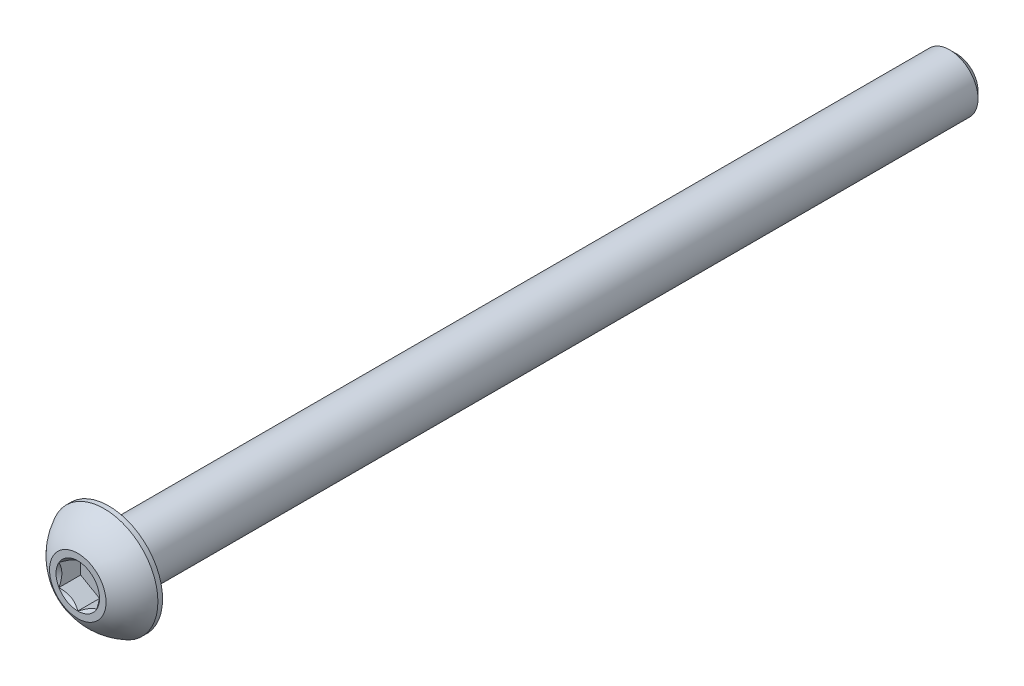
from build123d import *

# Parameters (mm, degrees)
CUT_EXTRUDE2_DEPTH = 1.155


with BuildPart() as part:
    # Sketch10 → Revolve3 (revolve)
    with BuildSketch(Plane(origin=(0, 0, 0), x_dir=(0, 0, -1), z_dir=(1, 0, 0))):
        Polygon((46.275, 1.5), (46.65, 1.125), (46.65, 0), (1.65, 0), (1.65, 1.5), align=None)
    revolve(axis=Axis((0, 0, 0), (0, 0, -1)))

    # Sketch7 → Revolve2 (revolve)
    with BuildSketch(Plane(origin=(0, 0, 0), x_dir=(0, 0, -1), z_dir=(1, 0, 0))):
        with BuildLine():
            Line((1.4025, 2.85), (1.65, 2.85))
            Line((1.65, 2.85), (1.65, 0))
            Line((1.65, 0), (0, 0))
            Line((0, 0), (0, 1.5))
            ThreePointArc((0, 1.5), (0.59512511, 2.285251969), (1.4025, 2.85))
        make_face()
    revolve(axis=Axis((0, 0, 0), (0, 0, -1)))

    # Sketch5 → Cut-Extrude2 (cut)
    with BuildSketch(Plane.XY):
        Polygon((1, -0.577350269), (1, 0.577350269), (0, 1.154700538), (-1, 0.577350269), (-1, -0.577350269), (0, -1.154700538), align=None)
    extrude(amount=-CUT_EXTRUDE2_DEPTH, mode=Mode.SUBTRACT)

    # Cut-Extrude3 cone 1 section (through the dimple's axis) → Cut-Extrude3 (revolve, cut)
    with BuildSketch(Plane(origin=(0, 0, 0), x_dir=(0, -1, 0), z_dir=(1, 0, 0))):
        Polygon((0, 0), (1.154700538, 0), (0, 1.154700538), align=None)
    revolve(axis=Axis((0, 0, 0), (0, 0, -1)), mode=Mode.SUBTRACT)


solid = part.part
